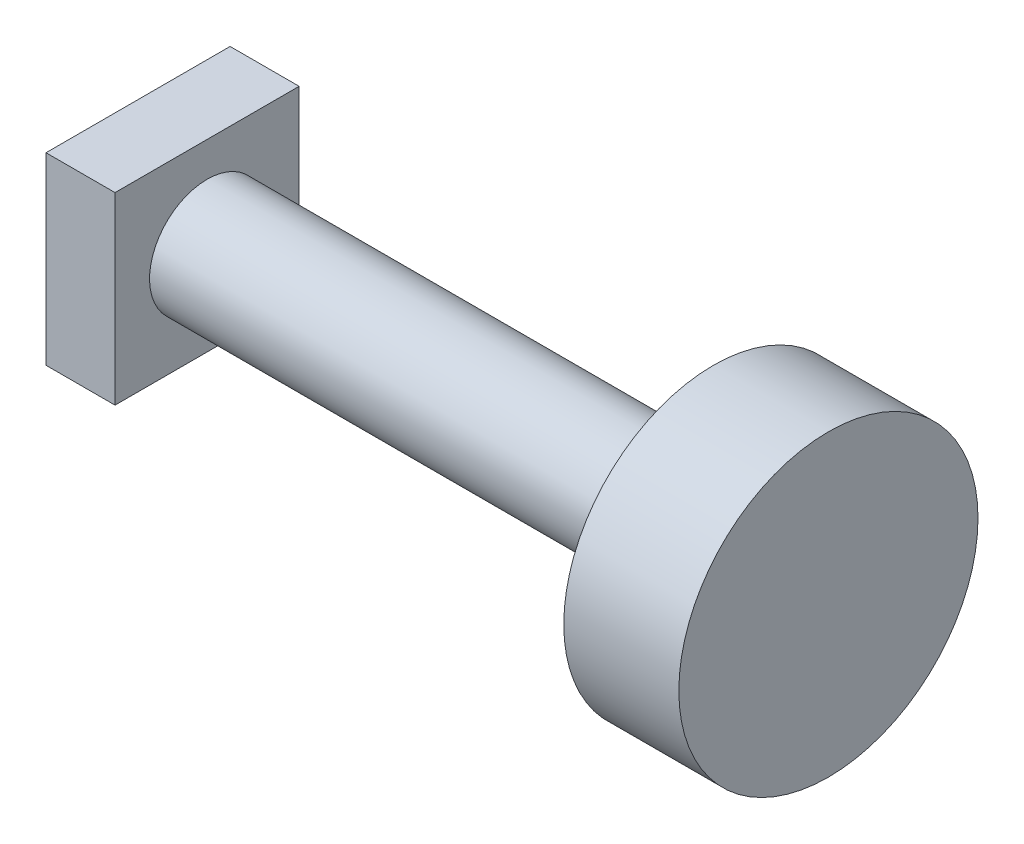
from build123d import *

# Parameters (mm, degrees)
SKETCH_3_W      = 8
SKETCH_3_H      = 8
EXTRUDE_1_DEPTH = 3


with BuildPart() as part:
    # 草圖1 → 旋轉1 (revolve)
    with BuildSketch(Plane.XY):
        Polygon((0, 0), (0, 2.5), (25, 2.5), (25, 6.5), (30, 6.5), (30, 0), align=None)
    revolve(axis=Axis((30, 0, 0), (-1, 0, 0)))

    # 草圖3 → 填料-伸長1 (add)
    with BuildSketch(Plane.ZY):
        Rectangle(SKETCH_3_W, SKETCH_3_H)
    extrude(amount=-EXTRUDE_1_DEPTH)


solid = part.part
